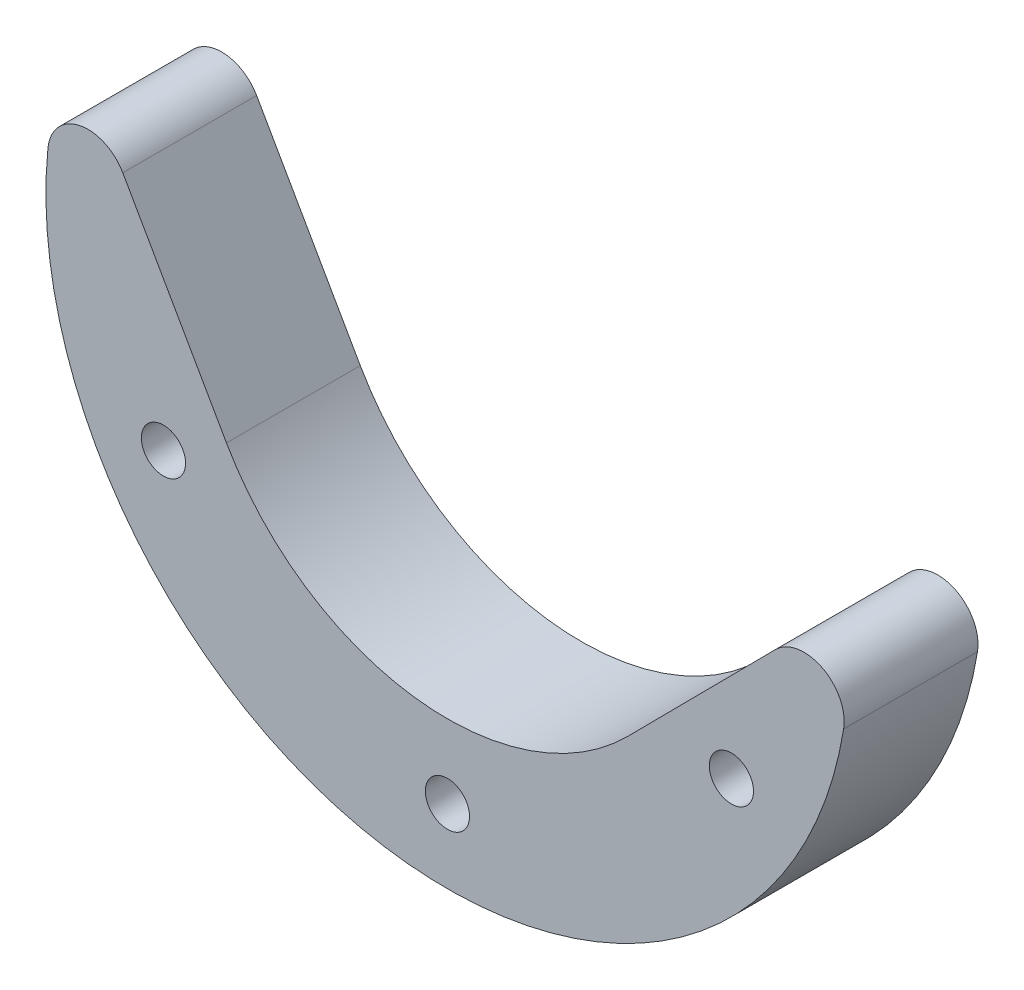
from build123d import *

# Parameters (mm, degrees)
SKETCH_1_R      = 1.65
EXTRUDE_2_DEPTH = 10
FILLET_2_R      = 3


with BuildPart() as part:
    # ｽｹｯﾁ1 → ﾎﾞｽ - 押し出し2 (new body)
    with BuildSketch(Plane.XY):
        with BuildLine():
            ThreePointArc((13.495853088, -13.373927973), (-2.494791786, -18.835498771), (-16.512205084, -9.399312914))
            Line((-16.512205084, -9.399312914), (-27.997360851, 10.777188196))
            ThreePointArc((-27.997360851, 10.777188196), (-5.480838188, -29.495091333), (30, 0))
            ThreePointArc((30, 0), (29.95938456, 1.560537335), (29.837648215, 3.116849208))
            Line((29.837648215, 3.116849208), (13.495853088, -13.373927973))
        make_face()
        with Locations((-21.217622393, -12.25)):
            Circle(SKETCH_1_R, mode=Mode.SUBTRACT)
        with Locations((0, -24.5)):
            Circle(SKETCH_1_R, mode=Mode.SUBTRACT)
        with Locations((21.217622393, -12.25)):
            Circle(SKETCH_1_R, mode=Mode.SUBTRACT)
    extrude(amount=EXTRUDE_2_DEPTH)

    # ﾌｨﾚｯﾄ2
    fillet_2_edges = [part.edges().sort_by_distance(p)[0] for p in [
        (29.837648215, 3.116849208, 5),
        (-27.997360851, 10.777188196, 5),
    ]]
    fillet(fillet_2_edges, radius=FILLET_2_R)


solid = part.part
